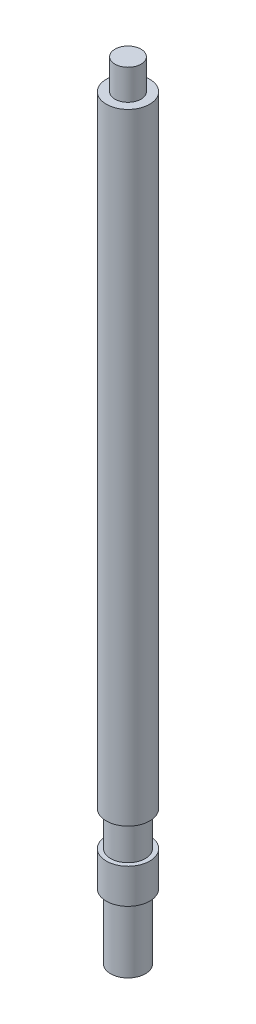
from build123d import *

# Parameters (mm, degrees)
SKETCH1_R           = 5
BOSS_EXTRUDE1_DEPTH = 143
SKETCH2_R           = 4
BOSS_EXTRUDE2_DEPTH = 8
BOSS_EXTRUDE3_START = 8
SKETCH3_R           = 5
BOSS_EXTRUDE3_DEPTH = 8
SKETCH4_R           = 4
BOSS_EXTRUDE4_DEPTH = 15
SKETCH5_R           = 3
BOSS_EXTRUDE5_DEPTH = 7


with BuildPart() as part:
    # Sketch1 → Boss-Extrude1 (new body)
    with BuildSketch(Plane(origin=(0, 0, 0), x_dir=(1, 0, 0), z_dir=(0, 1, 0))):
        with Locations(Location((0, 0, 0), (0, 0, 270))):
            Circle(SKETCH1_R)
    extrude(amount=BOSS_EXTRUDE1_DEPTH)

    # Sketch2 → Boss-Extrude2 (add)
    with BuildSketch(Plane.XZ):
        with Locations(Location((0, 0, 0), (0, 0, 270))):
            Circle(SKETCH2_R)
    extrude(amount=BOSS_EXTRUDE2_DEPTH)

    # Sketch3 → Boss-Extrude3 (add)
    with BuildSketch(Plane.XZ.offset(8).offset(BOSS_EXTRUDE3_START)):
        with Locations(Location((0, 0, 0), (0, 0, 90))):
            Circle(SKETCH3_R)
    extrude(amount=-BOSS_EXTRUDE3_DEPTH)

    # Sketch4 → Boss-Extrude4 (add)
    with BuildSketch(Plane.XZ.offset(16)):
        with Locations(Location((0, 0, 0), (0, 0, 270))):
            Circle(SKETCH4_R)
    extrude(amount=BOSS_EXTRUDE4_DEPTH)

    # Sketch5 → Boss-Extrude5 (add)
    with BuildSketch(Plane(origin=(0, 143, 0), x_dir=(1, 0, 0), z_dir=(0, 1, 0))):
        with Locations(Location((0, 0, 0), (0, 0, 270))):
            Circle(SKETCH5_R)
    extrude(amount=BOSS_EXTRUDE5_DEPTH)


solid = part.part
